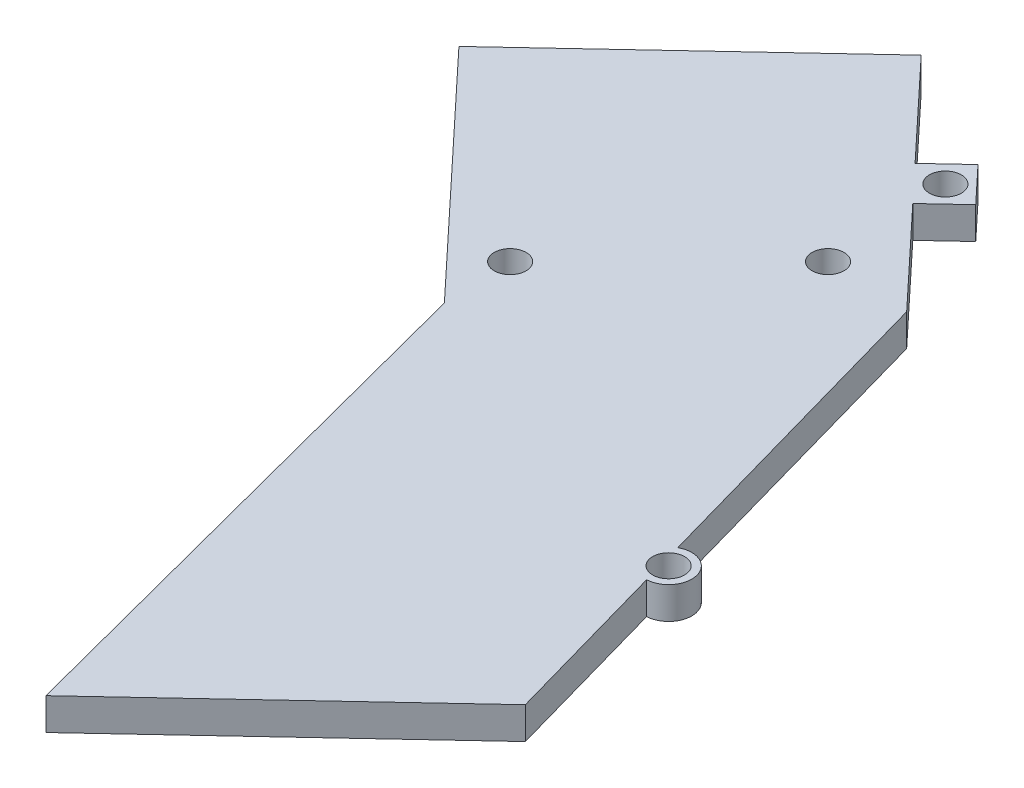
from build123d import *

# Parameters (mm, degrees)
SKETCH1_R           = 3.175
BOSS_EXTRUDE1_DEPTH = 6.35


with BuildPart() as part:
    # Sketch1 → Boss-Extrude1 (new body)
    with BuildSketch(Plane(origin=(0, 0, 0), x_dir=(1, 0, 0), z_dir=(0, 1, 0))):
        with BuildLine():
            Line((45.017746951, 2.631829887), (35.550660053, 36.209226482))
            ThreePointArc((35.550660053, 36.209226482), (39.762177432, 42.05307025), (33.11828595, 44.83625091))
            Line((33.11828595, 44.83625091), (15.243844224, 108.232438689))
            Line((15.243844224, 108.232438689), (-2.783728935, 127.479661752))
            Line((-2.783728935, 127.479661752), (3.678966496, 133.532831827))
            Line((3.678966496, 133.532831827), (-3.005742225, 140.669792455))
            Line((-3.005742225, 140.669792455), (-9.468437655, 134.61662238))
            Line((-9.468437655, 134.61662238), (-27.496010814, 153.863845442))
            Line((-27.496010814, 153.863845442), (-74.966911398, 109.401060841))
            Line((-74.966911398, 109.401060841), (-32.227053049, 63.769650553))
            Line((-32.227053049, 63.769650553), (-4.208751998, -43.475305064))
            Line((-4.208751998, -43.475305064), (45.017746951, 2.631829887))
        make_face()
        with Locations(Location((-2.894634056, 134.074815557, 0), (0, 0, 270))):
            Circle(SKETCH1_R, mode=Mode.SUBTRACT)
        with Locations(Location((35.334305242, 40.804639607, 0), (0, 0, 270))):
            Circle(SKETCH1_R, mode=Mode.SUBTRACT)
        with Locations(Location((-32.808552916, 77.429328599, 0), (0, 0, 270))):
            Circle(SKETCH1_R, mode=Mode.SUBTRACT)
        with Locations(Location((-1.199981142, 109.041759799, 0), (0, 0, 270))):
            Circle(SKETCH1_R, mode=Mode.SUBTRACT)
    extrude(amount=BOSS_EXTRUDE1_DEPTH)


solid = part.part
